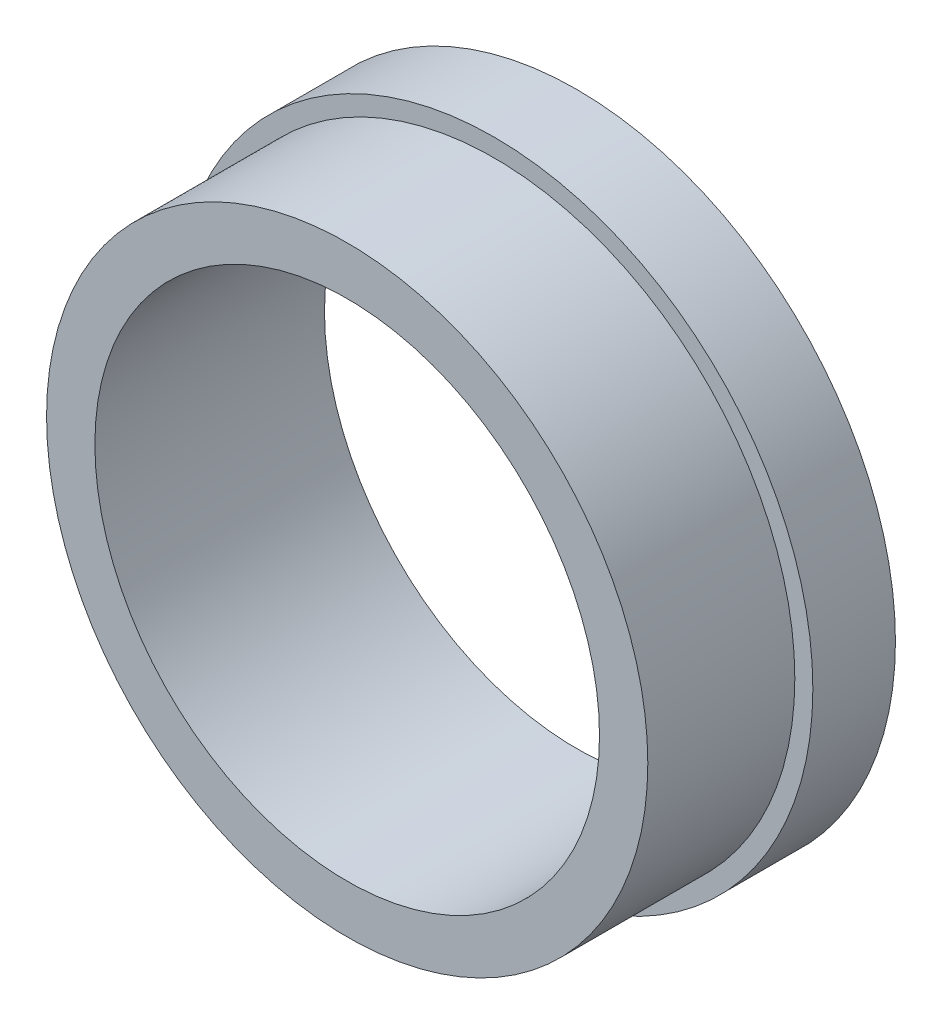
from build123d import *

# Parameters (mm, degrees)
SKETCH1_R         = 49
SKETCH1_R_2       = 38.7985
EXTRUDE1_DEPTH    = 35.306
SKETCH2_OUTSIDE_W = 128.604
SKETCH2_OUTSIDE_H = 128.604
SKETCH2_OUTSIDE_R = 46.228
EXTRUDE2_DEPTH    = 22.606


with BuildPart() as part:
    # Sketch1 → Extrude1 (new body)
    with BuildSketch(Plane.XY):
        with Locations(Location((0, 0, 0), (0, 0, 180))):
            Circle(SKETCH1_R)
        with Locations(Location((0, 0, 0), (0, 0, 180))):
            Circle(SKETCH1_R_2, mode=Mode.SUBTRACT)
    extrude(amount=EXTRUDE1_DEPTH)

    # Sketch2 outside → Extrude2 (cut)
    with BuildSketch(Plane.XY.offset(35.306)):
        Rectangle(SKETCH2_OUTSIDE_W, SKETCH2_OUTSIDE_H)
        Circle(SKETCH2_OUTSIDE_R, mode=Mode.SUBTRACT)
    extrude(amount=-EXTRUDE2_DEPTH, mode=Mode.SUBTRACT)


solid = part.part
